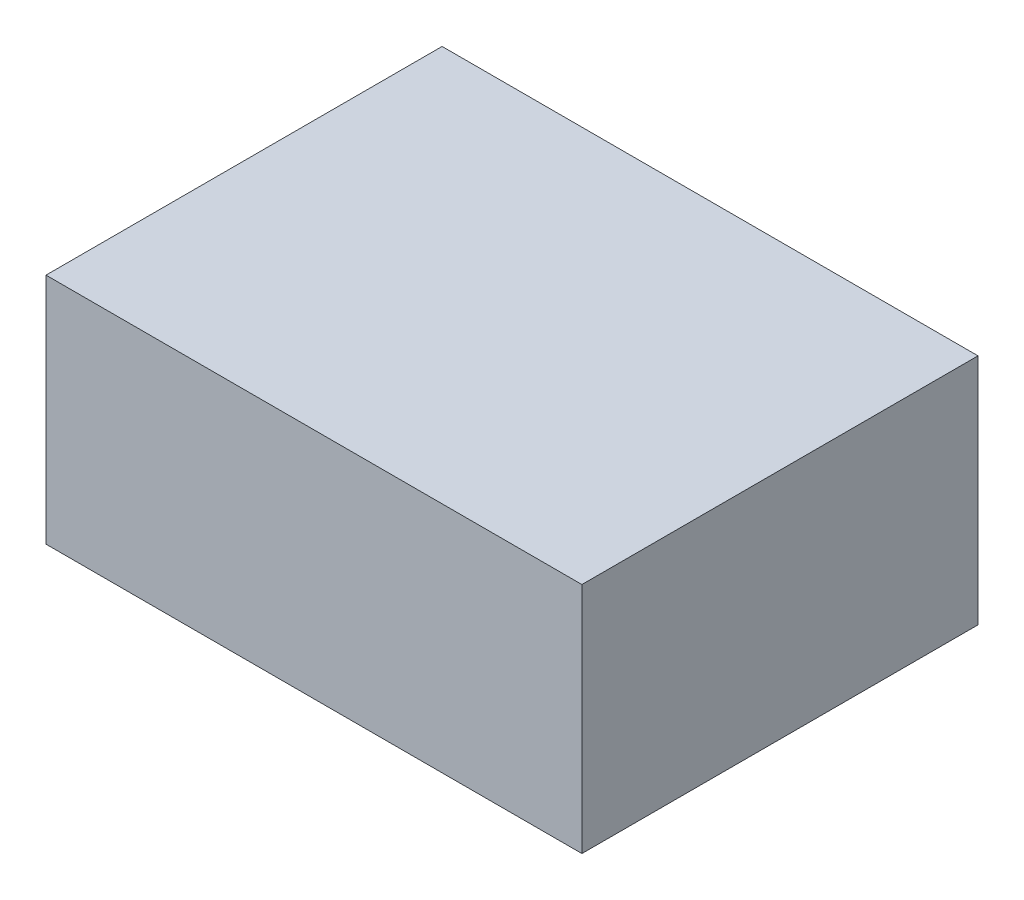
from build123d import *

# Parameters (mm, degrees)
SKETCH1_W           = 229.9999972
SKETCH1_H           = 170
BOSS_EXTRUDE1_DEPTH = 100


with BuildPart() as part:
    # Sketch1 → Boss-Extrude1 (new body)
    with BuildSketch(Plane(origin=(0, 0, 0), x_dir=(1, 0, 0), z_dir=(0, 1, 0))):
        with Locations((114.9999986, -85)):
            Rectangle(SKETCH1_W, SKETCH1_H)
    extrude(amount=BOSS_EXTRUDE1_DEPTH)


solid = part.part
